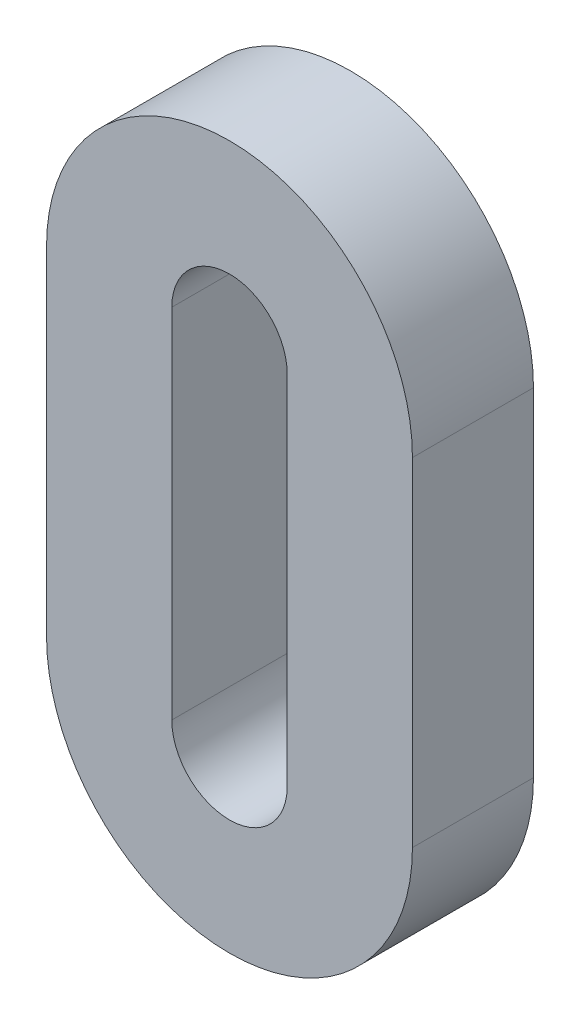
from build123d import *

# Parameters (mm, degrees)
BOSS_EXTRUDE1_DEPTH = 4.3


with BuildPart() as part:
    # Sketch1 → Boss-Extrude1 (new body)
    with BuildSketch(Plane.XY):
        with BuildLine():
            Line((-11.502754658, 6), (-11.502754658, -6))
            ThreePointArc((-11.502754658, -6), (-18.002754658, -12.5), (-24.502754658, -6))
            Line((-24.502754658, -6), (-24.502754658, 6))
            ThreePointArc((-24.502754658, 6), (-18.002754658, 12.5), (-11.502754658, 6))
        make_face()
        with BuildLine():
            Line((-15.952754658, 6.35), (-15.952754658, -6.35))
            ThreePointArc((-15.952754658, -6.35), (-18.002754658, -8.4), (-20.052754658, -6.35))
            Line((-20.052754658, -6.35), (-20.052754658, 6.35))
            ThreePointArc((-20.052754658, 6.35), (-18.002754658, 8.4), (-15.952754658, 6.35))
        make_face(mode=Mode.SUBTRACT)
    extrude(amount=BOSS_EXTRUDE1_DEPTH)


solid = part.part
